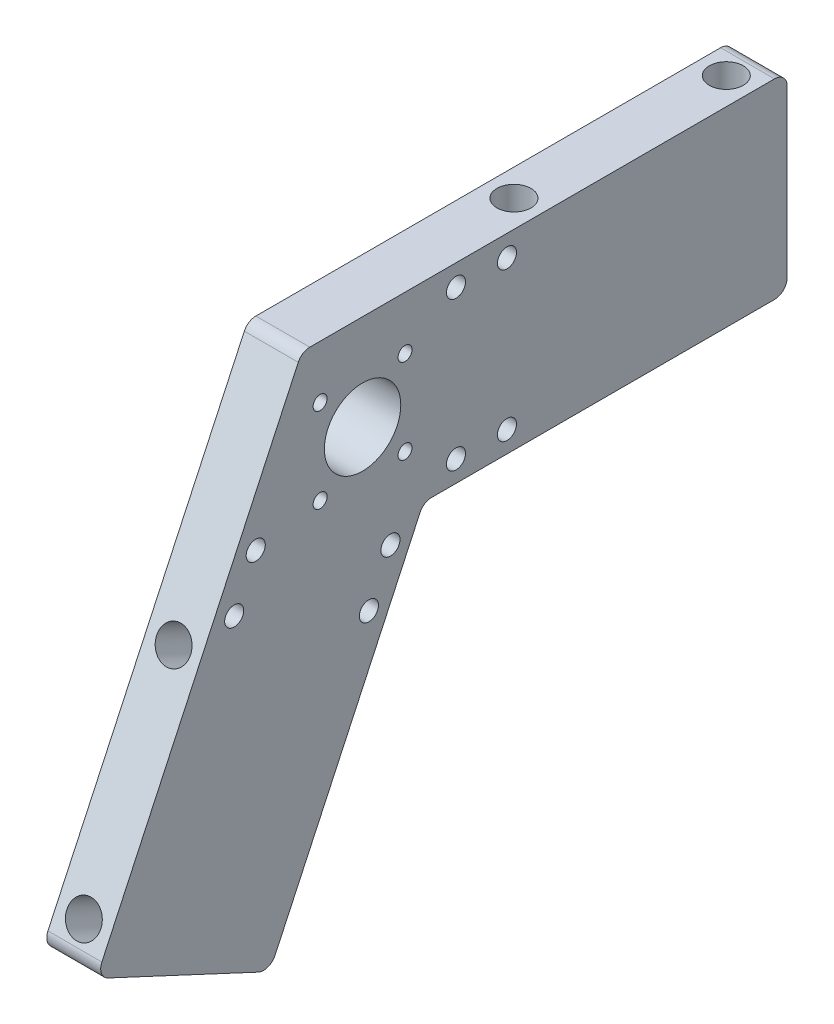
from build123d import *

# Parameters (mm, degrees)
CROQUIS1_R                    = 9
SALIENTE_EXTRUIR1_DEPTH       = 6.35
DI_METRO_DE_TALADRO_5_0_5_1_D = 8
DI_METRO_DE_TALADRO_5_0_5_2_D = 8
REDONDEO1_R                   = 3
TALADRO_ROSCADO_M4X0_71_D     = 3.3
TALADRO_DE_MARGEN_PARA_M41_D  = 4.5


with BuildPart() as part:
    # Croquis1 → Saliente-Extruir1 (new, symmetric)
    with BuildSketch(Plane(origin=(0, 0, 0), x_dir=(0, 0, -1), z_dir=(1, 0, 0))):
        Polygon((14.334080868, -22.5), (-21.869900966, -100.139689593), (-62.653751382, -81.121867814), (-14.334080868, 22.5), (100, 22.5), (100, -22.5), align=None)
        Circle(CROQUIS1_R, mode=Mode.SUBTRACT)
    extrude(amount=SALIENTE_EXTRUIR1_DEPTH, both=True)

    # Diámetro de taladro Ø5.0 (5)1 (through all)
    with Locations(Plane(origin=(0, 22.5, 0), x_dir=(1, 0, 0), z_dir=(0, 1, 0))):
        with Locations((0, 92), (0, 42)):
            Hole(DI_METRO_DE_TALADRO_5_0_5_1_D / 2)

    # Diámetro de taladro Ø5.0 (5)2 (through all)
    with Locations(Plane(origin=(0, 9.508910889, 20.391925208), x_dir=(1, 0, 0), z_dir=(0, 0.4226182617407033, 0.9063077870366483))):
        with Locations((0, -42), (0, -92)):
            Hole(DI_METRO_DE_TALADRO_5_0_5_2_D / 2)

    # Redondeo1
    redondeo1_edges = [part.edges().sort_by_distance(p)[0] for p in [
        (0, -22.5, -14.334080868),
        (0, -100.139689593, 21.869900966),
        (0, -81.121867814, 62.653751382),
        (0, 22.5, 14.334080868),
        (0, 22.5, -100),
        (0, -22.5, -100),
    ]]
    fillet(redondeo1_edges, radius=REDONDEO1_R)

    # Taladro roscado M4x0.71 (through all)
    with Locations(Plane.ZY.offset(6.35)):
        with Locations((10, 10), (-10, 10), (-10, -10), (10, -10)):
            Hole(TALADRO_ROSCADO_M4X0_71_D / 2)

    # Taladro de margen para M41 (through all)
    with Locations(Plane.ZY.offset(6.35)):
        with Locations((-6.562784515, -27.334590895), (-1.491365374, -38.21028434), (25.157988031, -12.542951734), (30.229407172, -23.418645179), (-22, 17.5), (-22, -17.5), (-34, 17.5), (-34, -17.5)):
            Hole(TALADRO_DE_MARGEN_PARA_M41_D / 2)


solid = part.part
